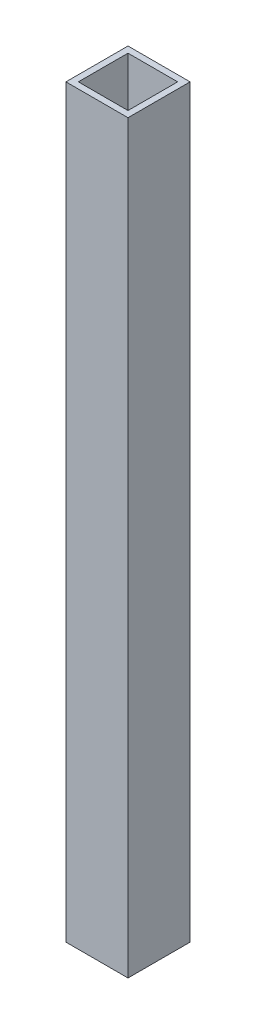
from build123d import *

# Parameters (mm, degrees)
SKETCH_1_W      = 10
SKETCH_1_H      = 10
SKETCH_1_W_2    = 8
SKETCH_1_H_2    = 8
EXTRUDE_1_DEPTH = 120


with BuildPart() as part:
    # 草图1 → 凸台-拉伸1 (new body)
    with BuildSketch(Plane(origin=(0, 0, 0), x_dir=(1, 0, 0), z_dir=(0, 1, 0))):
        Rectangle(SKETCH_1_W, SKETCH_1_H)
        Rectangle(SKETCH_1_W_2, SKETCH_1_H_2, mode=Mode.SUBTRACT)
    extrude(amount=EXTRUDE_1_DEPTH)


solid = part.part
